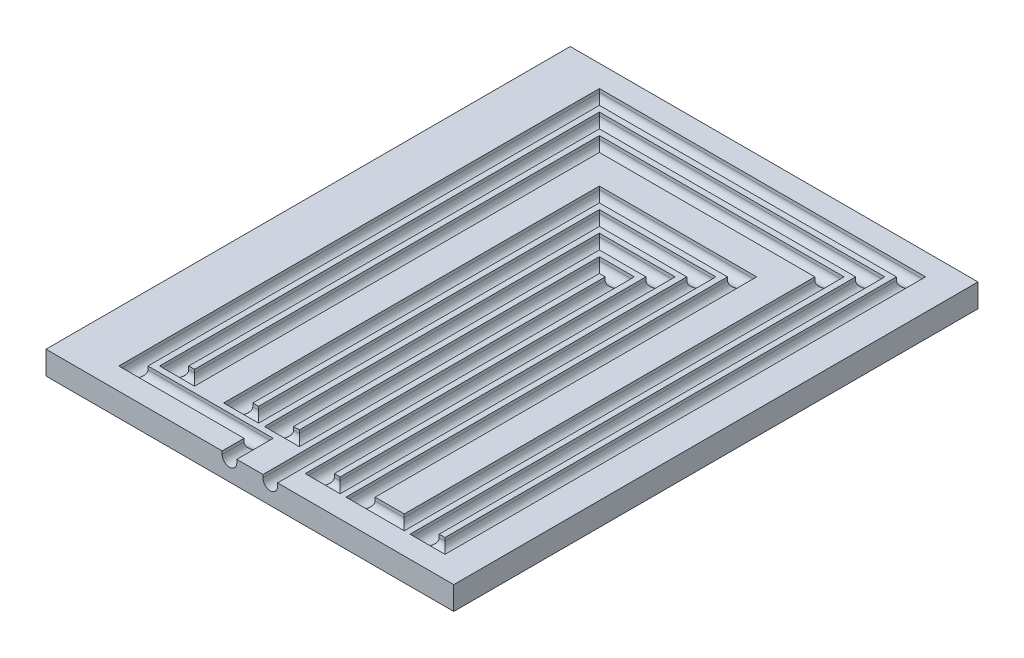
from build123d import *

# Parameters (mm, degrees)
SKETCH1_W           = 177.8
SKETCH1_H           = 228.6
BOSS_EXTRUDE1_DEPTH = 10.16


with BuildPart() as part:
    # Sketch1 → Boss-Extrude1 (new body)
    with BuildSketch(Plane(origin=(0, 0, 0), x_dir=(1, 0, 0), z_dir=(0, 1, 0))):
        Rectangle(SKETCH1_W, SKETCH1_H)
    extrude(amount=BOSS_EXTRUDE1_DEPTH)

    # Cut-Sweep2: sweep along a path in Sketch2
    with BuildLine(Plane(origin=(0, 10.16, 0), x_dir=(1, 0, 0), z_dir=(0, 1, 0))) as cut_sweep2_path:
        Line((8.89, -114.3), (8.89, 38.1))
        Line((8.89, 38.1), (0, 38.1))
        Line((0, 38.1), (0, -92.71))
        Line((0, -92.71), (-8.89, -92.71))
        Line((-8.89, -92.71), (-8.89, 46.99))
        Line((-8.89, 46.99), (17.78, 46.99))
        Line((17.78, 46.99), (17.78, -101.6))
        Line((17.78, -101.6), (26.67, -101.6))
        Line((26.67, -101.6), (26.67, 55.88))
        Line((26.67, 55.88), (-17.78, 55.88))
        Line((-17.78, 55.88), (-17.78, -92.71))
        Line((-17.78, -92.71), (-26.67, -92.71))
        Line((-26.67, -92.71), (-26.67, 64.77))
        Line((-26.67, 64.77), (35.56, 64.77))
        Line((35.56, 64.77), (35.56, -101.6))
        Line((35.56, -101.6), (54.61, -101.6))
        Line((54.61, -101.6), (54.61, 83.82))
        Line((54.61, 83.82), (-45.72, 83.82))
        Line((-45.72, 83.82), (-45.72, -92.71))
        Line((-45.72, -92.71), (-54.61, -92.71))
        Line((-54.61, -92.71), (-54.61, 92.71))
        Line((-54.61, 92.71), (63.5, 92.71))
        Line((63.5, 92.71), (63.5, -101.6))
        Line((63.5, -101.6), (72.39, -101.6))
        Line((72.39, -101.6), (72.39, 101.6))
        Line((72.39, 101.6), (-63.5, 101.6))
        Line((-63.5, 101.6), (-63.5, -101.6))
        Line((-63.5, -101.6), (-8.89, -101.6))
        Line((-8.89, -101.6), (-8.89, -114.3))
    # Sketch4 → Cut-Sweep2 (sweep, cut)
    with BuildSketch(Plane.XY.offset(114.3)):
        with BuildLine():
            Line((-5.715, 10.16), (-5.715, 8.760933946))
            ThreePointArc((-5.715, 8.760933946), (-8.89, 5.585933946), (-12.065, 8.760933946))
            Line((-12.065, 8.760933946), (-12.065, 10.16))
            ThreePointArc((-12.065, 10.16), (-8.89, 13.335), (-5.715, 10.16))
        make_face()
    sweep(path=cut_sweep2_path.line, transition=Transition.RIGHT, mode=Mode.SUBTRACT)


solid = part.part
